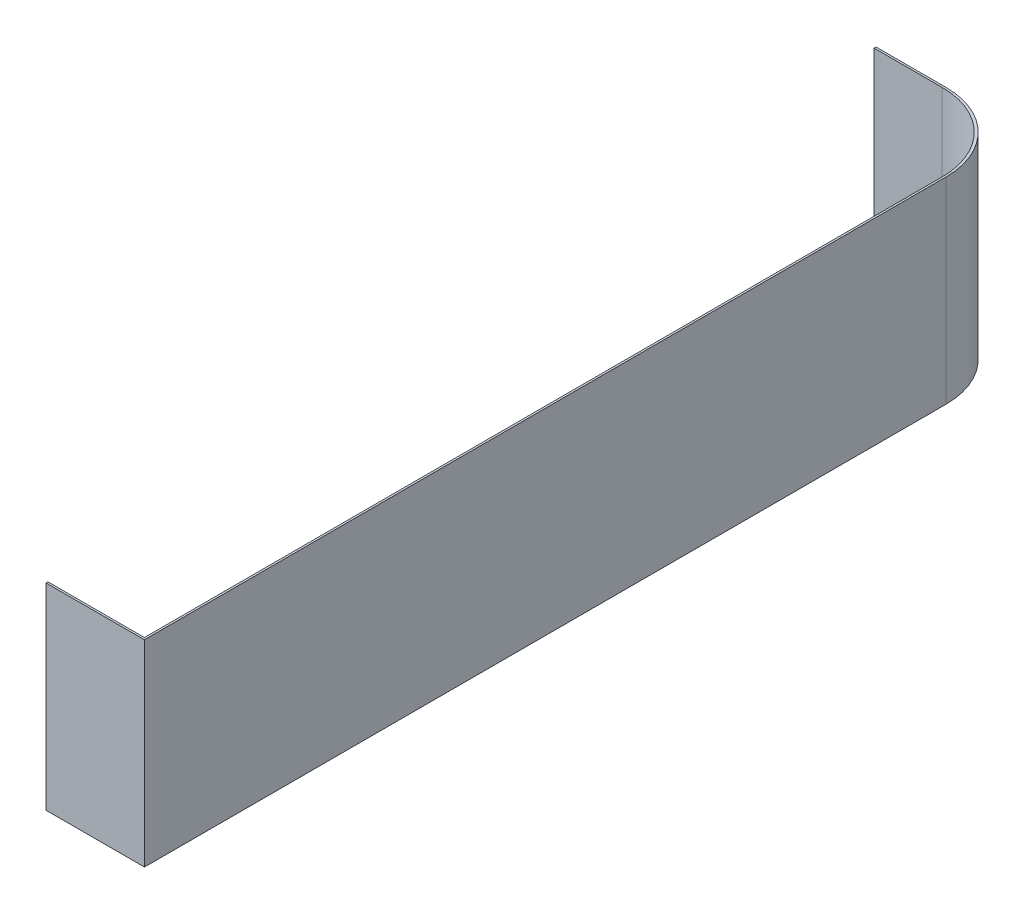
from build123d import *

# Parameters (mm, degrees)
BOSS_EXTRUDE1_DEPTH = 50.8
FILLET1_R           = 20


with BuildPart() as part:
    # Sketch1 → Boss-Extrude1 (new body)
    with BuildSketch(Plane(origin=(0, 0, 0), x_dir=(1, 0, 0), z_dir=(0, 1, 0))):
        Polygon((0, 0), (0, -0.5), (37.5999, -0.5), (37.5999, -226.3634), (12.6999, -226.3634), (12.6999, -226.8634), (38.0999, -226.8634), (38.0999, 0), align=None)
    extrude(amount=BOSS_EXTRUDE1_DEPTH)

    # Fillet1
    fillet1_edges = [part.edges().sort_by_distance(p)[0] for p in [
        (38.0999, 25.4, 0),
        (37.5999, 25.4, 0.5),
    ]]
    fillet(fillet1_edges, radius=FILLET1_R)


solid = part.part
